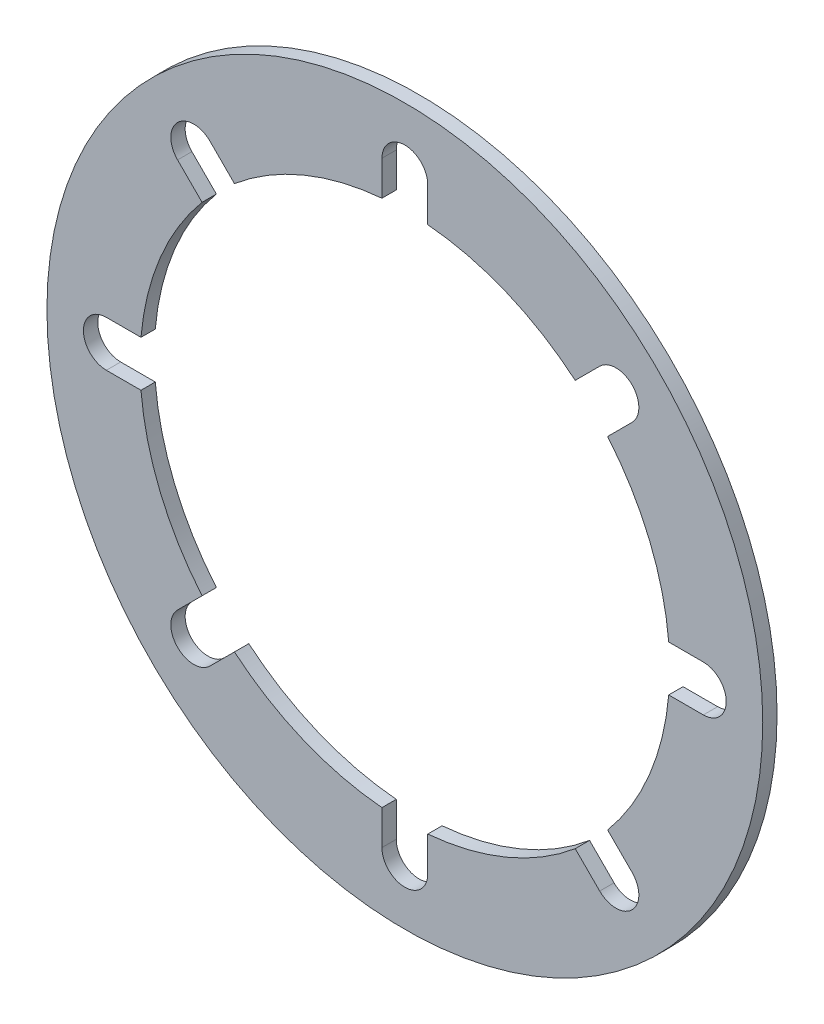
from build123d import *

# Parameters (mm, degrees)
SKETCH_1_R      = 25
EXTRUDE_1_DEPTH = 1


with BuildPart() as part:
    # 草图1 → 凸台-拉伸1 (new body)
    with BuildSketch(Plane.XY):
        Circle(SKETCH_1_R)
        with BuildLine():
            Line((-1.6, 20.85), (-1.6, 18.430680942))
            ThreePointArc((-1.6, 18.430680942), (-7.079643499, 17.091771351), (-11.901088626, 14.163830326))
            Line((-11.901088626, 14.163830326), (-13.611805538, 15.874547238))
            ThreePointArc((-13.611805538, 15.874547238), (-15.874547238, 15.874547238), (-15.874547238, 13.611805538))
            Line((-15.874547238, 13.611805538), (-14.163830326, 11.901088626))
            ThreePointArc((-14.163830326, 11.901088626), (-17.091771351, 7.079643499), (-18.430680942, 1.6))
            Line((-18.430680942, 1.6), (-20.85, 1.6))
            ThreePointArc((-20.85, 1.6), (-22.45, 0), (-20.85, -1.6))
            Line((-20.85, -1.6), (-18.430680942, -1.6))
            ThreePointArc((-18.430680942, -1.6), (-17.091771351, -7.079643499), (-14.163830326, -11.901088626))
            Line((-14.163830326, -11.901088626), (-15.874547238, -13.611805538))
            ThreePointArc((-15.874547238, -13.611805538), (-15.874547238, -15.874547238), (-13.611805538, -15.874547238))
            Line((-13.611805538, -15.874547238), (-11.901088626, -14.163830326))
            ThreePointArc((-11.901088626, -14.163830326), (-7.079643499, -17.091771351), (-1.6, -18.430680942))
            Line((-1.6, -18.430680942), (-1.6, -20.85))
            ThreePointArc((-1.6, -20.85), (0, -22.45), (1.6, -20.85))
            Line((1.6, -20.85), (1.6, -18.430680942))
            ThreePointArc((1.6, -18.430680942), (7.079643499, -17.091771351), (11.901088626, -14.163830326))
            Line((11.901088626, -14.163830326), (13.611805538, -15.874547238))
            ThreePointArc((13.611805538, -15.874547238), (15.874547238, -15.874547238), (15.874547238, -13.611805538))
            Line((15.874547238, -13.611805538), (14.163830326, -11.901088626))
            ThreePointArc((14.163830326, -11.901088626), (17.091771351, -7.079643499), (18.430680942, -1.6))
            Line((18.430680942, -1.6), (20.85, -1.6))
            ThreePointArc((20.85, -1.6), (22.45, 0), (20.85, 1.6))
            Line((20.85, 1.6), (18.430680942, 1.6))
            ThreePointArc((18.430680942, 1.6), (17.091771351, 7.079643499), (14.163830326, 11.901088626))
            Line((14.163830326, 11.901088626), (15.874547238, 13.611805538))
            ThreePointArc((15.874547238, 13.611805538), (15.874547238, 15.874547238), (13.611805538, 15.874547238))
            Line((13.611805538, 15.874547238), (11.901088626, 14.163830326))
            ThreePointArc((11.901088626, 14.163830326), (7.079643499, 17.091771351), (1.6, 18.430680942))
            Line((1.6, 18.430680942), (1.6, 20.85))
            ThreePointArc((1.6, 20.85), (0, 22.45), (-1.6, 20.85))
        make_face(mode=Mode.SUBTRACT)
    extrude(amount=EXTRUDE_1_DEPTH)


solid = part.part
